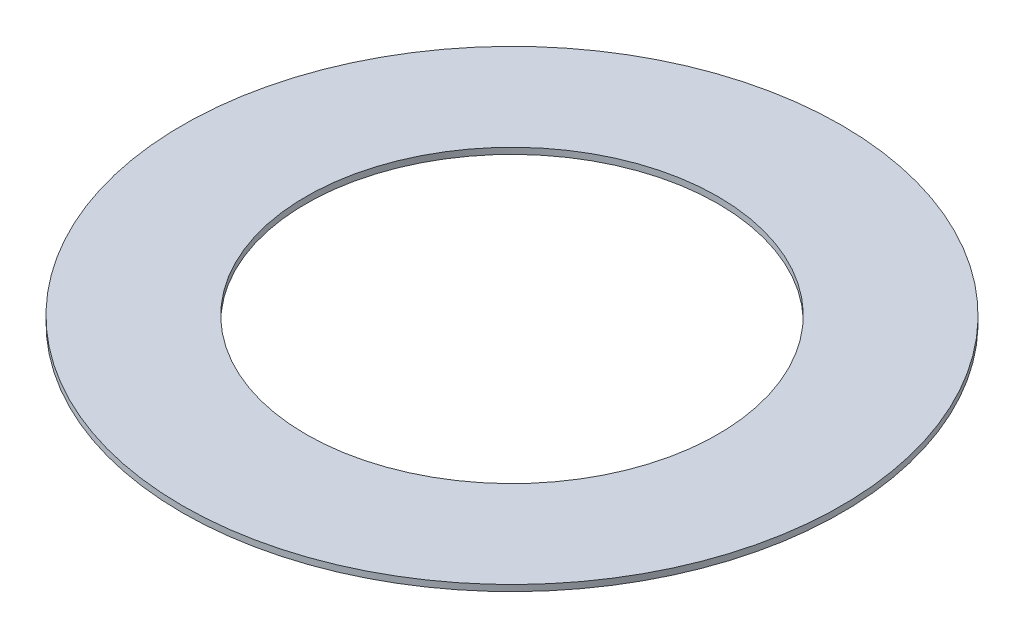
from build123d import *

# Parameters (mm, degrees)
SKETCH_1_R      = 80
SKETCH_1_R_2    = 50
EXTRUDE_1_DEPTH = 1.5


with BuildPart() as part:
    # 草图1 → 凸台-拉伸1 (new body)
    with BuildSketch(Plane(origin=(0, 0, 0), x_dir=(1, 0, 0), z_dir=(0, 1, 0))):
        with Locations(Location((0, 0, 0), (0, 0, 270))):
            Circle(SKETCH_1_R)
        with Locations(Location((0, 0, 0), (0, 0, 270))):
            Circle(SKETCH_1_R_2, mode=Mode.SUBTRACT)
    extrude(amount=EXTRUDE_1_DEPTH)


solid = part.part
